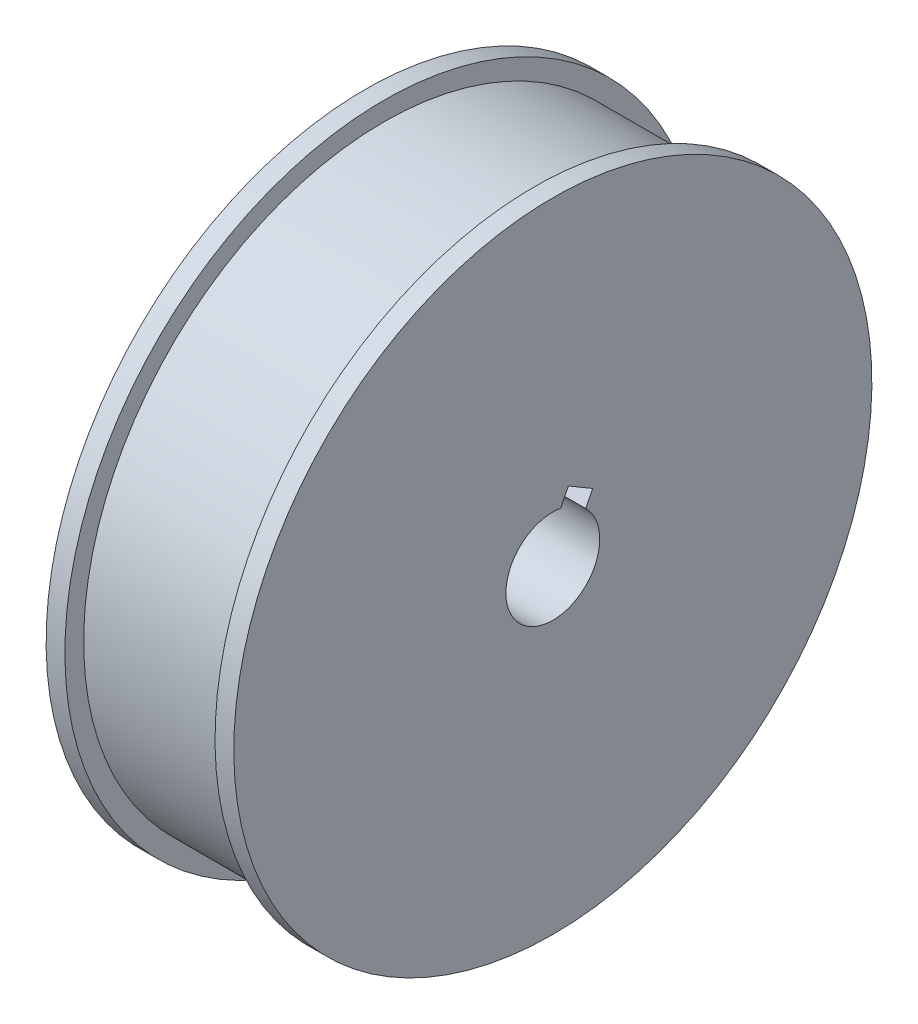
from build123d import *

# Parameters (mm, degrees)
SKETCH1_W          = 31.75
SKETCH1_H          = 50.8
SKETCH1_W_2        = 3.175
SKETCH1_H_2        = 3.175
CUT_EXTRUDE1_DEPTH = 83.672025196


with BuildPart() as part:
    # Sketch1 → Revolve1 (revolve)
    with BuildSketch(Plane.XY, mode=Mode.PRIVATE) as revolve1_sk:
        with Locations((0, 25.4)):
            Rectangle(SKETCH1_W, SKETCH1_H)
        with Locations((-14.2875, 52.3875)):
            Rectangle(SKETCH1_W_2, SKETCH1_H_2)
        with Locations((14.2875, 52.3875)):
            Rectangle(SKETCH1_W_2, SKETCH1_H_2)
    revolve(revolve1_sk.sketch.rotate(Axis((-15.875, 0, 0), (1, 0, 0)), 180), axis=Axis((-15.875, 0, 0), (1, 0, 0)))

    # Sketch2 → Cut-Extrude1 (cut, through all)
    with BuildSketch(Plane.ZY.offset(15.875)):
        with BuildLine():
            Line((-6.745565901, 8.004027254), (-5.556686402, 5.668081023))
            ThreePointArc((-5.556686402, 5.668081023), (3.600316682, -7.074010605), (-1.312280039, 7.828271032))
            Line((-1.312280039, 7.828271032), (-2.632559092, 10.422395062))
            Line((-2.632559092, 10.422395062), (-6.745565901, 8.004027254))
        make_face()
    extrude(amount=-CUT_EXTRUDE1_DEPTH, mode=Mode.SUBTRACT)


solid = part.part
